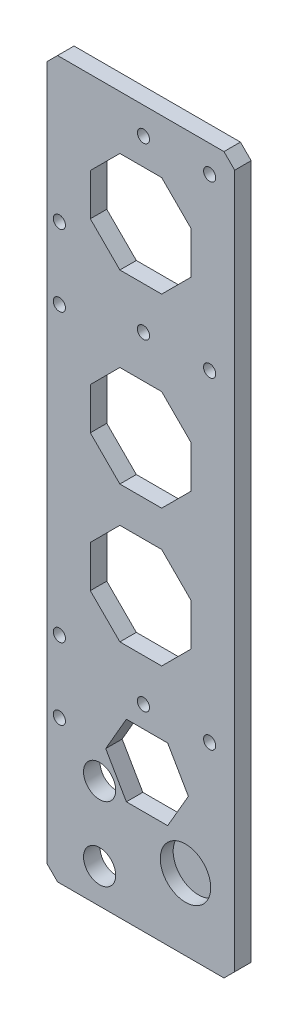
from build123d import *

# Parameters (mm, degrees)
CROQUIS1_W                   = 200
CROQUIS1_H                   = 52.5
SALIENTE_EXTRUIR1_DEPTH      = 4.6
CROQUIS2_R                   = 7.05
CORTAR_EXTRUIR1_DEPTH        = 3.6
TALADRO_DE_MARGEN_PARA_M31_D = 3.4
CHAFL_N1_SIZE                = 3
TALADRO_DE_MARGEN_PARA_M32_D = 3.4
CORTAR_EXTRUIR2_DEPTH        = 104.490204851
TALADRO_DE_MARGEN_PARA_M33_D = 3.4
TALADRO_DE_MARGEN_PARA_M81_D = 9


with BuildPart() as part:
    # Croquis1 → Saliente-Extruir1 (new body)
    with BuildSketch(Plane(origin=(0, 0, 0), x_dir=(0, 1, 0), z_dir=(0, 0, 1))):
        Rectangle(CROQUIS1_W, CROQUIS1_H)
    extrude(amount=SALIENTE_EXTRUIR1_DEPTH)

    # Croquis2 → Cortar-Extruir1 (cut)
    with BuildSketch(Plane.XY.offset(4.6)):
        with Locations((12.5, -80)):
            Circle(CROQUIS2_R)
    extrude(amount=-CORTAR_EXTRUIR1_DEPTH, mode=Mode.SUBTRACT)

    # Taladro de margen para M31 (through all)
    with Locations(Plane(origin=(0, 0, 0), x_dir=(1, 0, 0), z_dir=(0, 0, -1))):
        with Locations((19.25, -45), (19.25, 45), (0.75, 45), (0.75, -45)):
            Hole(TALADRO_DE_MARGEN_PARA_M31_D / 2)

    # Chaflán1
    chafl_n1_edges = [part.edges().sort_by_distance(p)[0] for p in [
        (26.25, 100, 2.3),
        (26.25, -100, 2.3),
        (-26.25, -100, 2.3),
        (-26.25, 100, 2.3),
    ]]
    chamfer(chafl_n1_edges, length=CHAFL_N1_SIZE)

    # Taladro de margen para M32 (through all)
    with Locations(Plane.XY.offset(4.6)):
        with Locations((-22.75, -60), (-22.75, -40), (-22.75, 40), (-22.75, 60)):
            Hole(TALADRO_DE_MARGEN_PARA_M32_D / 2)

    # Croquis8 → Cortar-Extruir2 (cut, through all)
    with BuildSketch(Plane.XY.offset(4.6)):
        Polygon((-5.840411229, 33.2), (5.840411229, 33.2), (14.1, 24.940411229), (14.1, 13.259588771), (5.840411229, 5), (-5.840411229, 5), (-14.1, 13.259588771), (-14.1, 24.940411229), align=None)
        Polygon((5.840411229, -33.2), (14.1, -24.940411229), (14.1, -13.259588771), (5.840411229, -5), (-5.840411229, -5), (-14.1, -13.259588771), (-14.1, -24.940411229), (-5.840411229, -33.2), align=None)
        Polygon((13.297005384, -61), (7.523502692, -51), (-4.023502692, -51), (-9.797005384, -61), (-4.023502692, -71), (7.523502692, -71), align=None)
        Polygon((5.840411229, 56.8), (14.1, 65.059588771), (14.1, 76.740411229), (5.840411229, 85), (-5.840411229, 85), (-14.1, 76.740411229), (-14.1, 65.059588771), (-5.840411229, 56.8), align=None)
    extrude(amount=-CORTAR_EXTRUIR2_DEPTH, mode=Mode.SUBTRACT)

    # Taladro de margen para M33 (through all)
    with Locations(Plane.XY.offset(4.6)):
        with Locations((0.75, 92.5), (19.25, 92.5)):
            Hole(TALADRO_DE_MARGEN_PARA_M33_D / 2)

    # Taladro de margen para M81 (through all)
    with Locations(Plane(origin=(0, 0, 0), x_dir=(1, 0, 0), z_dir=(0, 0, -1))):
        with Locations((-11.5, 69.7), (-11.5, 90.3)):
            Hole(TALADRO_DE_MARGEN_PARA_M81_D / 2)


solid = part.part
